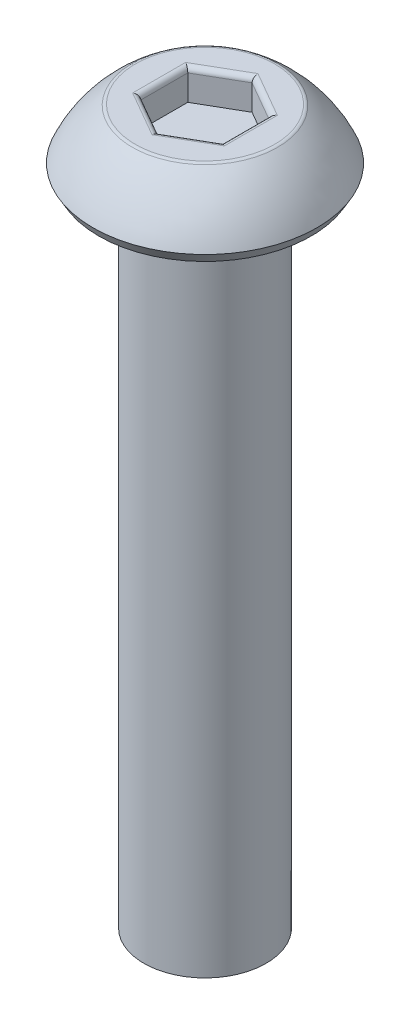
from build123d import *

# Parameters (mm, degrees)
CUT_EXTRUDE1_DEPTH = 0.75
FILLET1_R          = 0.125


with BuildPart() as part:
    # Sketch1 → Revolve1 (revolve)
    with BuildSketch(Plane(origin=(0, 0, 0), x_dir=(0, 0, -1), z_dir=(1, 0, 0)), mode=Mode.PRIVATE) as revolve1_sk:
        with BuildLine():
            Line((0, 1.5), (-1.75, 1.5))
            ThreePointArc((-1.75, 1.5), (-2.334912942, 0.942930354), (-2.75, 0.25))
            Line((-2.75, 0.25), (-2.605662433, 0))
            Line((-2.605662433, 0), (-1.5, 0))
            Line((-1.5, 0), (-1.5, -16))
            Line((-1.5, -16), (0, -16))
            Line((0, -16), (0, 1.5))
        make_face()
    revolve(revolve1_sk.sketch.rotate(Axis((0, -16, 0), (0, 1, 0)), 180), axis=Axis((0, -16, 0), (0, 1, 0)))

    # Sketch2 → Cut-Extrude1 (cut)
    with BuildSketch(Plane(origin=(0, 1.5, 0), x_dir=(1, 0, 0), z_dir=(0, 1, 0))):
        Polygon((0, 1.154700538), (-1, 0.577350269), (-1, -0.577350269), (0, -1.154700538), (1, -0.577350269), (1, 0.577350269), align=None)
    extrude(amount=-CUT_EXTRUDE1_DEPTH, mode=Mode.SUBTRACT)

    # Fillet1
    fillet1_edges = [part.edges().sort_by_distance(p)[0] for p in [
        (0.5, 1.5, -0.866025404),
        (-0.5, 1.5, -0.866025404),
        (-1, 1.5, 0),
        (-0.5, 1.5, 0.866025404),
        (0.5, 1.5, 0.866025404),
        (1, 1.5, 0),
        (0, 1.5, 1.75),
    ]]
    fillet(fillet1_edges, radius=FILLET1_R)


solid = part.part
